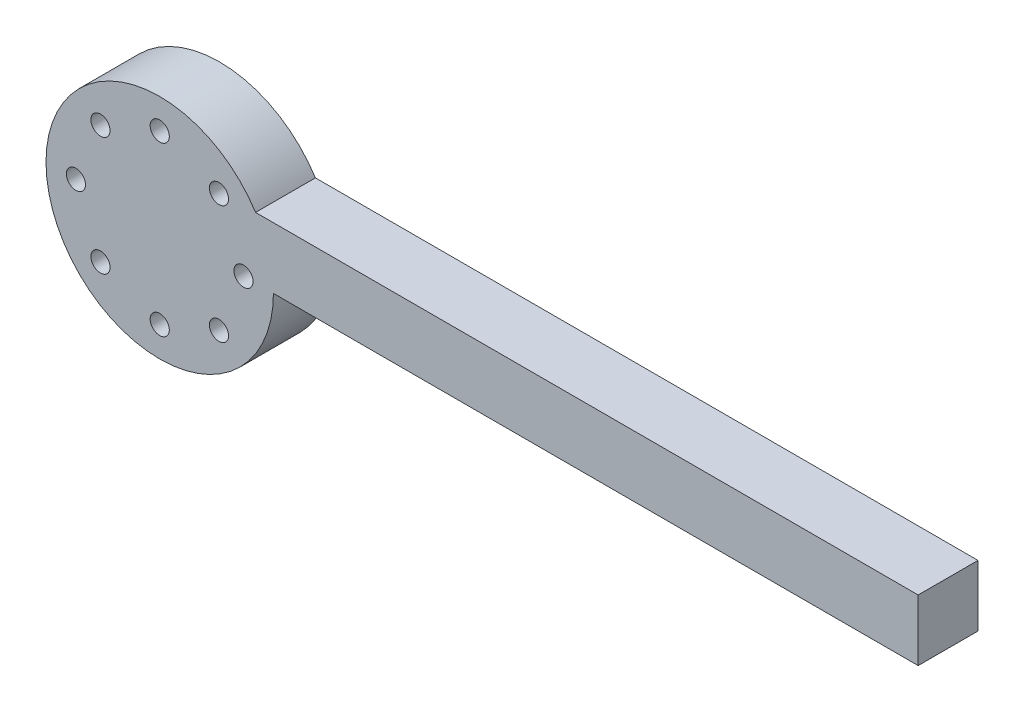
from build123d import *

# Parameters (mm, degrees)
SKETCH1_R           = 9.5
BOSS_EXTRUDE1_DEPTH = 5
BOSS_EXTRUDE2_DEPTH = 5
SKETCH4_R           = 0.8
CUT_EXTRUDE1_DEPTH  = 65.265761039


with BuildPart() as part:
    # Sketch1 → Boss-Extrude1 (new body)
    with BuildSketch(Plane.XY):
        Circle(SKETCH1_R)
    extrude(amount=BOSS_EXTRUDE1_DEPTH)

    # Sketch3 → Boss-Extrude2 (add)
    with BuildSketch(Plane(origin=(0, 0, 0), x_dir=(-1, 0, 0), z_dir=(0, 0, -1))):
        with BuildLine():
            Line((-8.007166595, 5.112267903), (-63.36274964, 5.112267903))
            Line((-63.36274964, 5.112267903), (-63.36274964, 0))
            Line((-63.36274964, 0), (-9.5, 0))
            ThreePointArc((-9.5, 0), (-9.119157929, 2.662885403), (-8.007166595, 5.112267903))
        make_face()
    extrude(amount=-BOSS_EXTRUDE2_DEPTH)

    # Sketch4 → Cut-Extrude1 (cut, through all)
    with BuildSketch(Plane(origin=(0, 0, 0), x_dir=(-1, 0, 0), z_dir=(0, 0, -1))):
        with Locations((0, 7)):
            Circle(SKETCH4_R)
        with Locations((4.949747468, 4.949747468)):
            Circle(SKETCH4_R)
        with Locations((7, 0)):
            Circle(SKETCH4_R)
        with Locations((4.949747468, -4.949747468)):
            Circle(SKETCH4_R)
        with Locations((0, -7)):
            Circle(SKETCH4_R)
        with Locations((-4.949747468, -4.949747468)):
            Circle(SKETCH4_R)
        with Locations((-7, 0)):
            Circle(SKETCH4_R)
        with Locations((-4.949747468, 4.949747468)):
            Circle(SKETCH4_R)
    extrude(amount=-CUT_EXTRUDE1_DEPTH, mode=Mode.SUBTRACT)


solid = part.part
